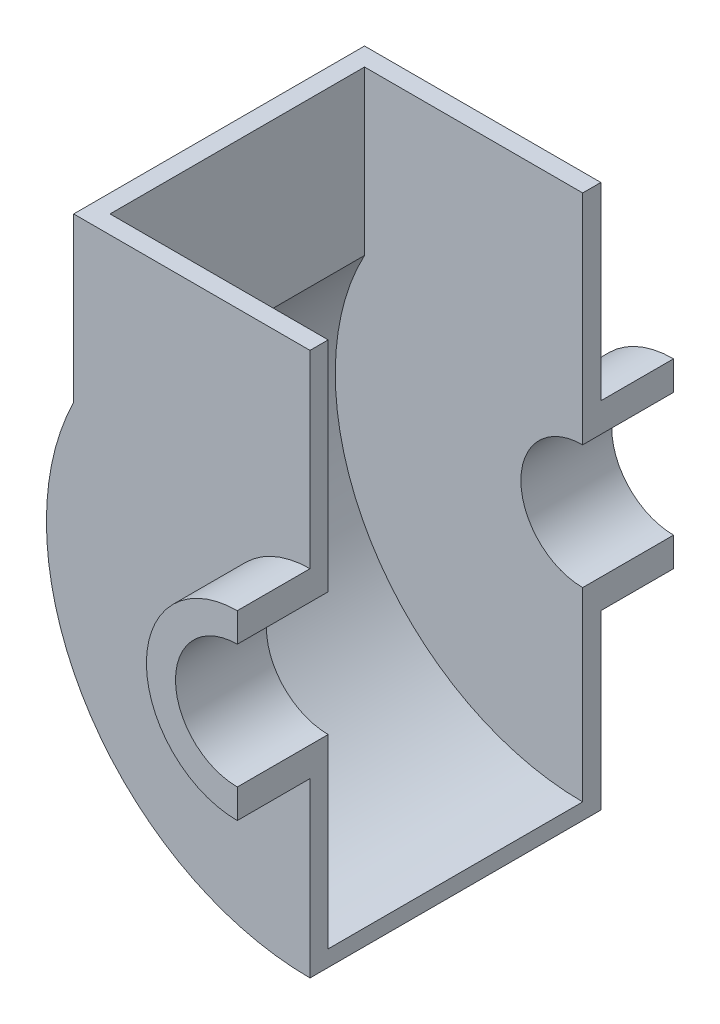
from build123d import *

# Parameters (mm, degrees)
BOSS_EXTRUDE1_DEPTH      = 20
BOSS_EXTRUDE1_DEPTH_BACK = 5
BOSS_EXTRUDE2_START      = -5
BOSS_EXTRUDE2_DEPTH      = 5
BOSS_EXTRUDE3_REACH      = 144.163


with BuildPart() as part:
    # Sketch1 → Boss-Extrude1 (new, two sides: drawn at the far end of the back side and taken through both)
    with BuildSketch(Plane.XY.offset(-BOSS_EXTRUDE1_DEPTH_BACK)):
        with BuildLine():
            Line((0, 25), (0, 17))
            ThreePointArc((0, 17), (-17, 0), (0, -17))
            Line((0, -17), (0, -25))
            ThreePointArc((0, -25), (-25, 0), (0, 25))
        make_face()
    extrude(amount=BOSS_EXTRUDE1_DEPTH + BOSS_EXTRUDE1_DEPTH_BACK)

    # Sketch5 → Boss-Extrude2 (add)
    with BuildSketch(Plane.XY.offset(BOSS_EXTRUDE2_START)):
        with BuildLine():
            ThreePointArc((0, 25), (-25, 0), (0, -25))
            Line((0, -25), (0, -72.5))
            ThreePointArc((0, -72.5), (-61.581037686, -38.262590053), (-65, 32.113081447))
            Line((-65, 32.113081447), (-65, 77))
            Line((-65, 77), (0, 77))
            Line((0, 77), (0, 25))
        make_face()
    extrude(amount=BOSS_EXTRUDE2_DEPTH)


with BuildPart() as body_2:
    # Mirror3: mirrored copy
    add(part.part.mirror(Plane.XY.offset(-40)))

    # Sketch9 → Boss-Extrude3 (add, up to next)
    with BuildSketch(Plane(origin=(0, 0, -5), x_dir=(-1, 0, 0), z_dir=(0, 0, -1)), mode=Mode.PRIVATE) as boss_extrude3_sk1:
        with BuildLine():
            Line((65, 32.113081447), (65, 77))
            Line((65, 77), (60, 77))
            Line((60, 77), (60, 32.113081447))
            ThreePointArc((60, 32.113081447), (58.380864924, -34.970339014), (0, -68.053287944))
            Line((0, -68.053287944), (0, -72.5))
            ThreePointArc((0, -72.5), (61.581037686, -38.262590053), (65, 32.113081447))
        make_face()
    boss_extrude3_tool1 = extrude(boss_extrude3_sk1.sketch, amount=BOSS_EXTRUDE3_REACH, mode=Mode.PRIVATE) - body_2.part

    add(part.part)  # Boss-Extrude3 merges part
    add(boss_extrude3_tool1.solids().sort_by_distance((-63.33848, 54.556541, -5))[0])


solid = body_2.part
